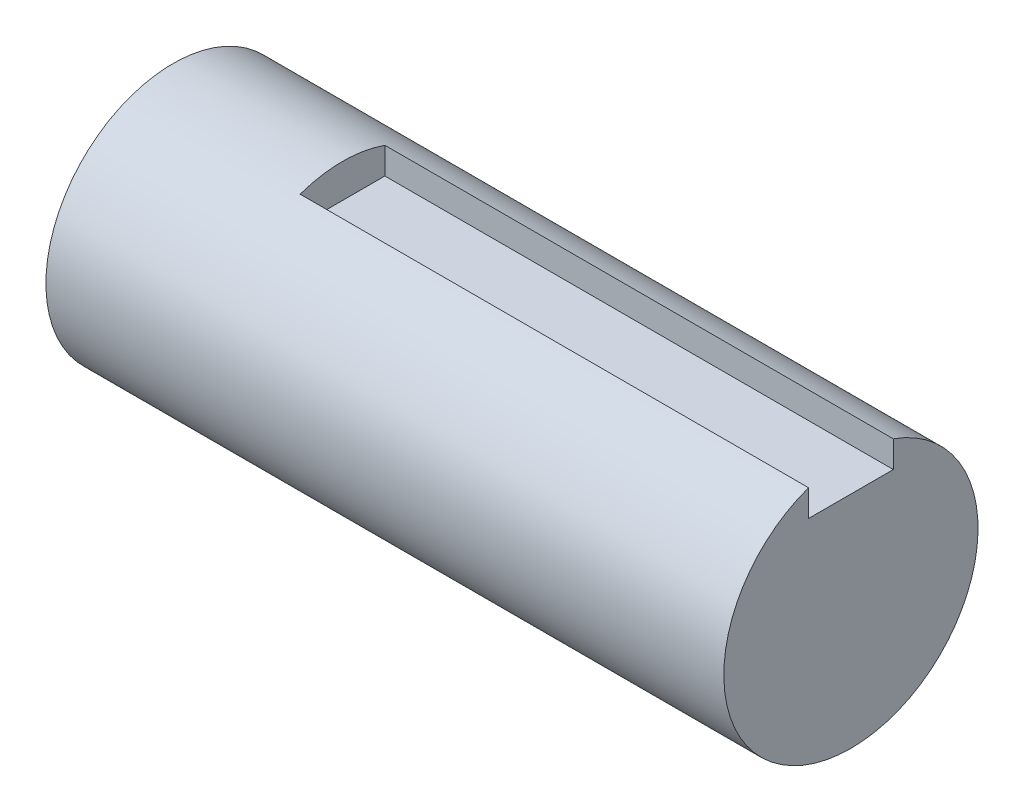
from build123d import *

# Parameters (mm, degrees)
SKETCH1_R           = 15
BOSS_EXTRUDE1_DEPTH = 80
CUT_EXTRUDE2_START  = -60
CUT_EXTRUDE2_DEPTH  = 60


with BuildPart() as part:
    # Sketch1 → Boss-Extrude1 (new body)
    with BuildSketch(Plane(origin=(0, 0, 0), x_dir=(0, 0, -1), z_dir=(1, 0, 0))):
        Circle(SKETCH1_R)
    extrude(amount=BOSS_EXTRUDE1_DEPTH)

    # Sketch2 → Cut-Extrude2 (cut)
    with BuildSketch(Plane(origin=(80, 0, 0), x_dir=(0, 0, -1), z_dir=(1, 0, 0)).offset(CUT_EXTRUDE2_START)):
        with BuildLine():
            ThreePointArc((5, 14.142135624), (2.536529681, 14.783978395), (0, 15))
            ThreePointArc((0, 15), (-2.536529681, 14.783978395), (-5, 14.142135624))
            Line((-5, 14.142135624), (-5, 11))
            Line((-5, 11), (0, 11))
            Line((0, 11), (5, 11))
            Line((5, 11), (5, 14.142135624))
        make_face()
    extrude(amount=CUT_EXTRUDE2_DEPTH, mode=Mode.SUBTRACT)


solid = part.part
